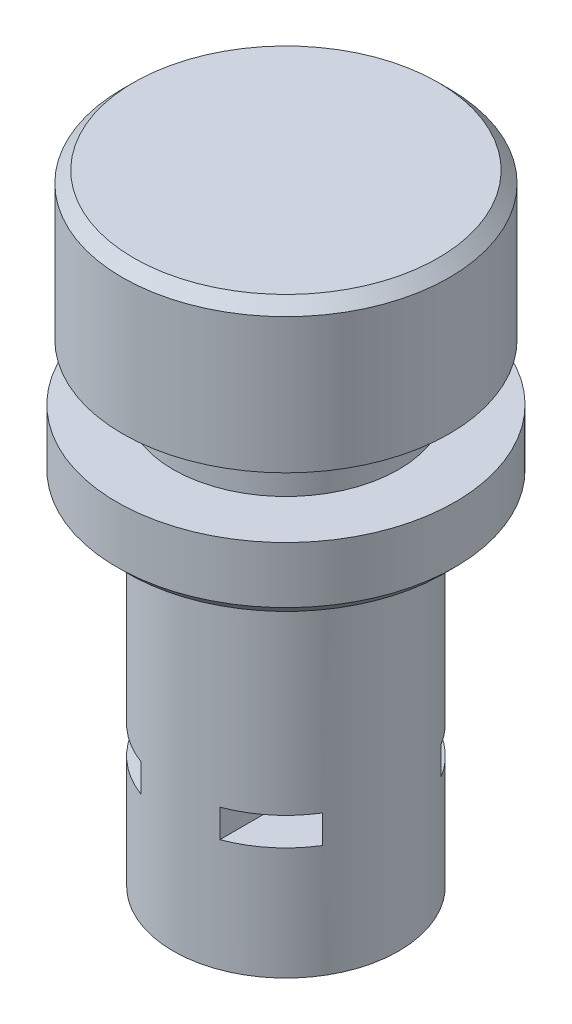
from build123d import *

# Parameters (mm, degrees)
SKETCH_1_R               = 14.5
EXTRUDE_1_DEPTH          = 13
CHAMFER_1_SIZE           = 1
SKETCH_2_R               = 10
EXTRUDE_2_DEPTH          = 42
CUT_EXTRUDE_1_DEPTH      = 47.738634982
CUT_EXTRUDE_1_DEPTH_BACK = 47.738634982
SKETCH_3_W               = 5
SKETCH_3_H               = 2.5
EXTRUDE_3_REACH          = 51.452
SKETCH_5_R               = 1
EXTRUDE_START            = 5
SKETCH_6_R               = 15
EXTRUDE_4_DEPTH          = 6
CHAMFER_3_SIZE           = 1


with BuildPart() as part:
    # Эскиз1 → Бобышка-Вытянуть1 (new body)
    with BuildSketch(Plane(origin=(0, 0, 0), x_dir=(1, 0, 0), z_dir=(0, 1, 0))):
        with Locations(Location((0, 0, 0), (0, 0, 90))):
            Circle(SKETCH_1_R)
    extrude(amount=EXTRUDE_1_DEPTH)

    # Фаска1
    chamfer_1_edges = [part.edges().sort_by_distance(p)[0] for p in [
        (0, 13, 14.5),
    ]]
    chamfer(chamfer_1_edges, length=CHAMFER_1_SIZE)

    # Эскиз2 → Бобышка-Вытянуть2 (add)
    with BuildSketch(Plane.XZ):
        with Locations(Location((0, 0, 0), (0, 0, 90))):
            Circle(SKETCH_2_R)
    extrude(amount=EXTRUDE_2_DEPTH)

    # Эскиз3 → Вырез-Вытянуть1 (cut, two sides: drawn at the far end of the back side and taken through both)
    with BuildSketch(Plane.XY.offset(-CUT_EXTRUDE_1_DEPTH_BACK)):
        with Locations((-6, -30.75)):
            Rectangle(SKETCH_3_W, SKETCH_3_H)
        with Locations((6, -30.75)):
            Rectangle(SKETCH_3_W, SKETCH_3_H)
    extrude(amount=CUT_EXTRUDE_1_DEPTH + CUT_EXTRUDE_1_DEPTH_BACK, mode=Mode.SUBTRACT)

    # Эскиз5 → Бобышка-Вытянуть3 (add, up to next)
    with BuildSketch(Plane(origin=(0, -32, 0), x_dir=(1, 0, 0), z_dir=(0, 1, 0)), mode=Mode.PRIVATE) as extrude_3_sk1:
        with Locations(Location((6, 0, 0), (0, 0, 90))):
            Circle(SKETCH_5_R)
    extrude_3_tool1 = extrude(extrude_3_sk1.sketch, amount=EXTRUDE_3_REACH, mode=Mode.PRIVATE) - part.part
    extrude_3 = extrude_3_tool1.solids().sort_by_distance((6, -32, 0))[0]
    add(extrude_3)

    # Зеркальное отражение1: Бобышка-Вытянуть3 across plane
    add(extrude_3.mirror(Plane(origin=(0, 0, 0), x_dir=(0, 0, 1), z_dir=(1, 0, 0))))

    # Эскиз6 → Бобышка-Вытянуть4 (add)
    with BuildSketch(Plane.XZ.offset(EXTRUDE_START)):
        with Locations(Location((0, 0, 0), (0, 0, 270))):
            Circle(SKETCH_6_R)
    extrude(amount=EXTRUDE_4_DEPTH)

    # Фаска3
    chamfer_3_edges = [part.edges().sort_by_distance(p)[0] for p in [
        (0, -11, 15),
    ]]
    chamfer(chamfer_3_edges, length=CHAMFER_3_SIZE)


solid = part.part
